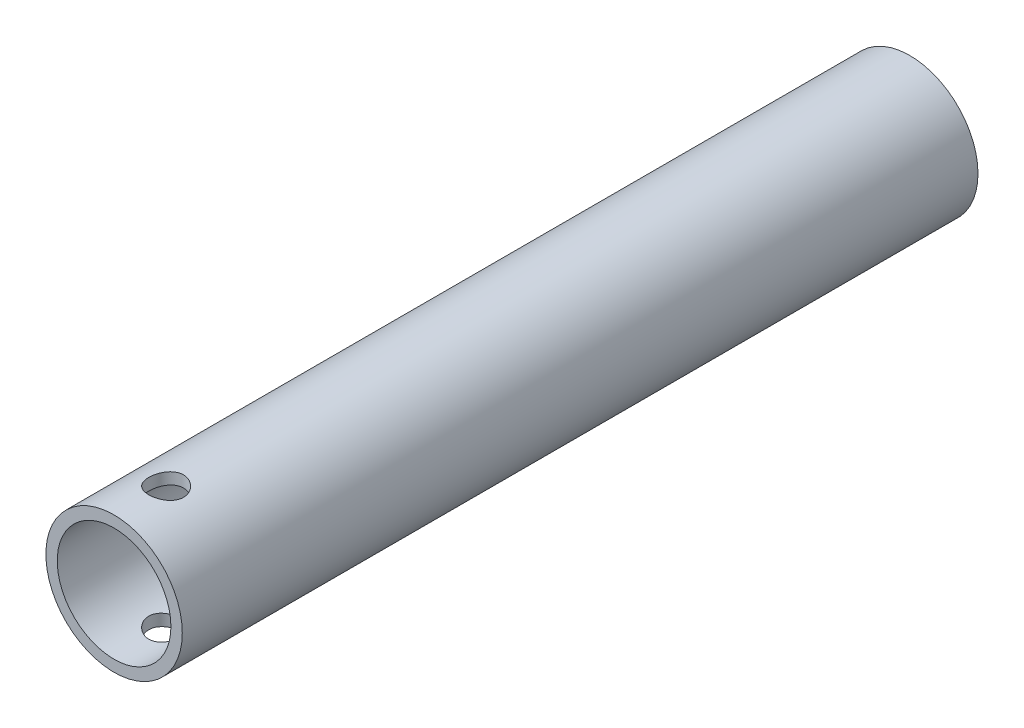
from build123d import *

# Parameters (mm, degrees)
BOSS_EXTRUDE2_DEPTH      = 152.4
BOSS_EXTRUDE2_DEPTH_BACK = 152.4
SKETCH3_R                = 6
SKETCH3_R_2              = 5
CUT_EXTRUDE1_DEPTH       = 153.636037684
CUT_EXTRUDE1_DEPTH_BACK  = 153.636037684
SKETCH4_R                = 1.524
SKETCH5_R                = 6
CUT_EXTRUDE2_DEPTH       = 234.8


with BuildPart() as part:
    # Sketch3 → Boss-Extrude2 (new, two sides: drawn at the far end of the back side and taken through both)
    with BuildSketch(Plane.XY.offset(-BOSS_EXTRUDE2_DEPTH_BACK)):
        with Locations(Location((0, 0, 0), (0, 0, 180))):
            Circle(SKETCH3_R)
        with Locations(Location((0, 0, 0), (0, 0, 180))):
            Circle(SKETCH3_R_2, mode=Mode.SUBTRACT)
    extrude(amount=BOSS_EXTRUDE2_DEPTH + BOSS_EXTRUDE2_DEPTH_BACK)

    # Sketch4 → Cut-Extrude1 (cut, two sides: drawn at the far end of the back side and taken through both)
    with BuildSketch(Plane(origin=(0, 0, 0), x_dir=(1, 0, 0), z_dir=(0, 1, 0)).offset(-CUT_EXTRUDE1_DEPTH_BACK)):
        with Locations(Location((0, -147.82, 0), (0, 0, 270))):
            Circle(SKETCH4_R)
    extrude(amount=CUT_EXTRUDE1_DEPTH + CUT_EXTRUDE1_DEPTH_BACK, mode=Mode.SUBTRACT)

    # Sketch5 → Cut-Extrude2 (cut)
    with BuildSketch(Plane(origin=(0, 0, -152.4), x_dir=(-1, 0, 0), z_dir=(0, 0, -1))):
        with Locations(Location((0, 0, 0), (0, 0, 180))):
            Circle(SKETCH5_R)
    extrude(amount=-CUT_EXTRUDE2_DEPTH, mode=Mode.SUBTRACT)


solid = part.part
